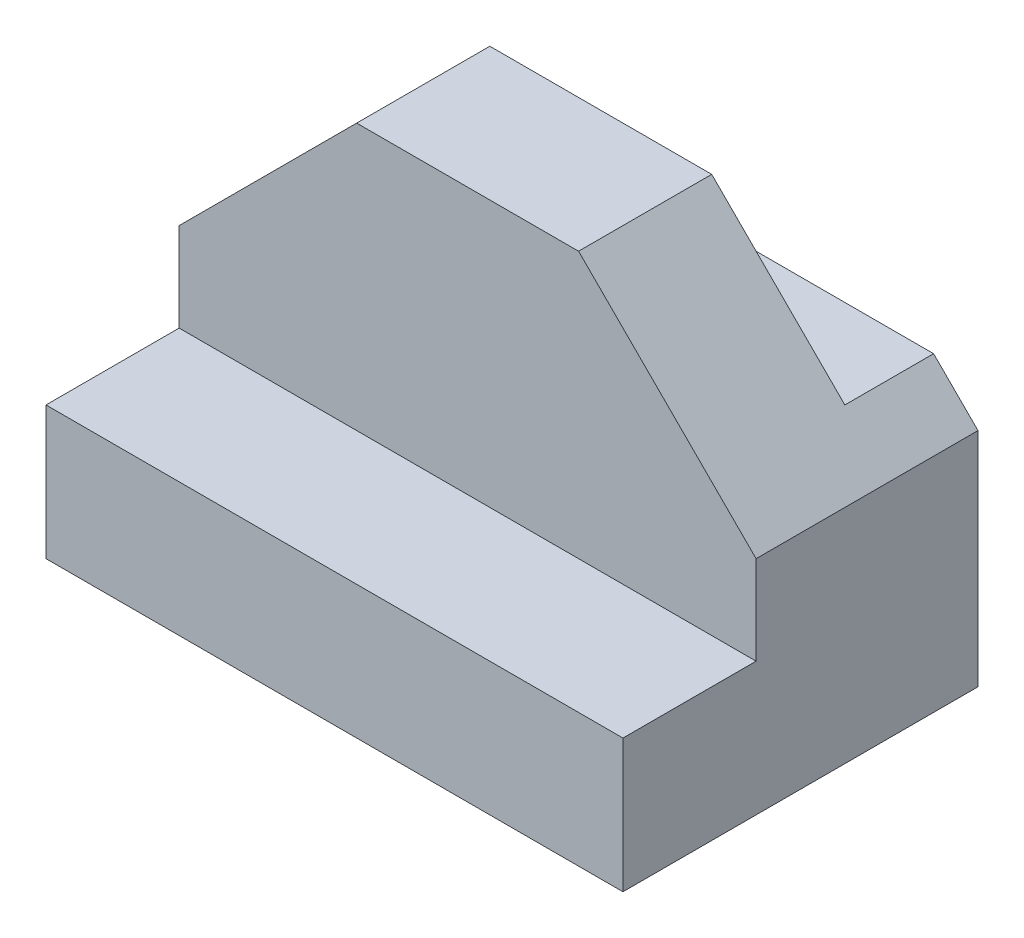
from build123d import *

# Parameters (mm, degrees)
BOSS_EXTRU_1_DEPTH = 65
CHANFREIN4_SIZE    = 20
CHANFREIN5_SIZE    = 20


with BuildPart() as part:
    # Esquisse1 → Boss.-Extru.1 (new body)
    with BuildSketch(Plane(origin=(0, 0, 0), x_dir=(0, 0, -1), z_dir=(1, 0, 0))):
        Polygon((-20.69418762, -12.633516796), (19.30581238, -12.633516796), (19.30581238, 17.366483204), (9.30581238, 17.366483204), (9.30581238, 32.366483204), (-5.69418762, 32.366483204), (-5.69418762, 2.366483204), (-20.69418762, 2.366483204), align=None)
    extrude(amount=BOSS_EXTRU_1_DEPTH)

    # Chanfrein4
    chanfrein4_edges = [part.edges().sort_by_distance(p)[0] for p in [
        (65, 32.366483204, -1.80581238),
    ]]
    chamfer(chanfrein4_edges, length=CHANFREIN4_SIZE)

    # Chanfrein5
    chanfrein5_edges = [part.edges().sort_by_distance(p)[0] for p in [
        (0, 32.366483204, -1.80581238),
    ]]
    chamfer(chanfrein5_edges, length=CHANFREIN5_SIZE)


solid = part.part
